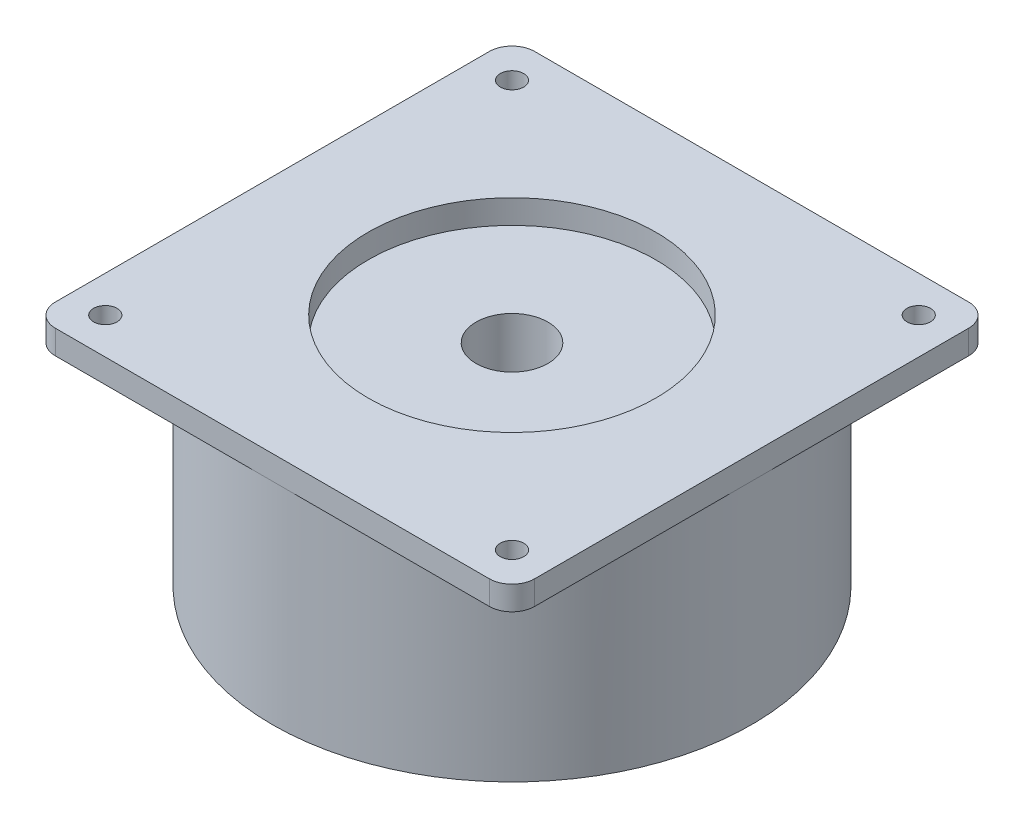
from build123d import *

# Parameters (mm, degrees)
SKETCH1_R           = 31.75
SKETCH1_R_2         = 4.7625
BOSS_EXTRUDE1_DEPTH = 27.94
SKETCH2_R           = 1.55575
BOSS_EXTRUDE2_DEPTH = 3.175
SKETCH3_R           = 19.05
CUT_EXTRUDE1_DEPTH  = 3.175


with BuildPart() as part:
    # Sketch1 → Boss-Extrude1 (new body)
    with BuildSketch(Plane(origin=(0, 0, 0), x_dir=(1, 0, 0), z_dir=(0, 1, 0))):
        with Locations(Location((0, 0, 0), (0, 0, 270))):
            Circle(SKETCH1_R)
        with Locations(Location((0, 0, 0), (0, 0, 270))):
            Circle(SKETCH1_R_2, mode=Mode.SUBTRACT)
    extrude(amount=BOSS_EXTRUDE1_DEPTH)

    # Sketch2 → Boss-Extrude2 (add)
    with BuildSketch(Plane(origin=(0, 27.94, 0), x_dir=(1, 0, 0), z_dir=(0, 1, 0))):
        with BuildLine():
            Line((-28.75, 31.75), (28.75, 31.75))
            ThreePointArc((28.75, 31.75), (30.871320344, 30.871320344), (31.75, 28.75))
            Line((31.75, 28.75), (31.75, -28.75))
            ThreePointArc((31.75, -28.75), (30.871320344, -30.871320344), (28.75, -31.75))
            Line((28.75, -31.75), (-28.75, -31.75))
            ThreePointArc((-28.75, -31.75), (-30.871320344, -30.871320344), (-31.75, -28.75))
            Line((-31.75, -28.75), (-31.75, 28.75))
            ThreePointArc((-31.75, 28.75), (-30.871320344, 30.871320344), (-28.75, 31.75))
        make_face()
        with Locations(Location((-26.940768363, 26.940768363, 0), (0, 0, 270))):
            Circle(SKETCH2_R, mode=Mode.SUBTRACT)
        with Locations(Location((26.940768363, 26.940768363, 0), (0, 0, 270))):
            Circle(SKETCH2_R, mode=Mode.SUBTRACT)
        with Locations(Location((26.940768363, -26.940768363, 0), (0, 0, 270))):
            Circle(SKETCH2_R, mode=Mode.SUBTRACT)
        with Locations(Location((-26.940768363, -26.940768363, 0), (0, 0, 270))):
            Circle(SKETCH2_R, mode=Mode.SUBTRACT)
    extrude(amount=BOSS_EXTRUDE2_DEPTH)

    # Sketch3 → Cut-Extrude1 (cut)
    with BuildSketch(Plane(origin=(0, 31.115, 0), x_dir=(1, 0, 0), z_dir=(0, 1, 0))):
        with Locations(Location((0, 0, 0), (0, 0, 270))):
            Circle(SKETCH3_R)
    extrude(amount=-CUT_EXTRUDE1_DEPTH, mode=Mode.SUBTRACT)


solid = part.part
